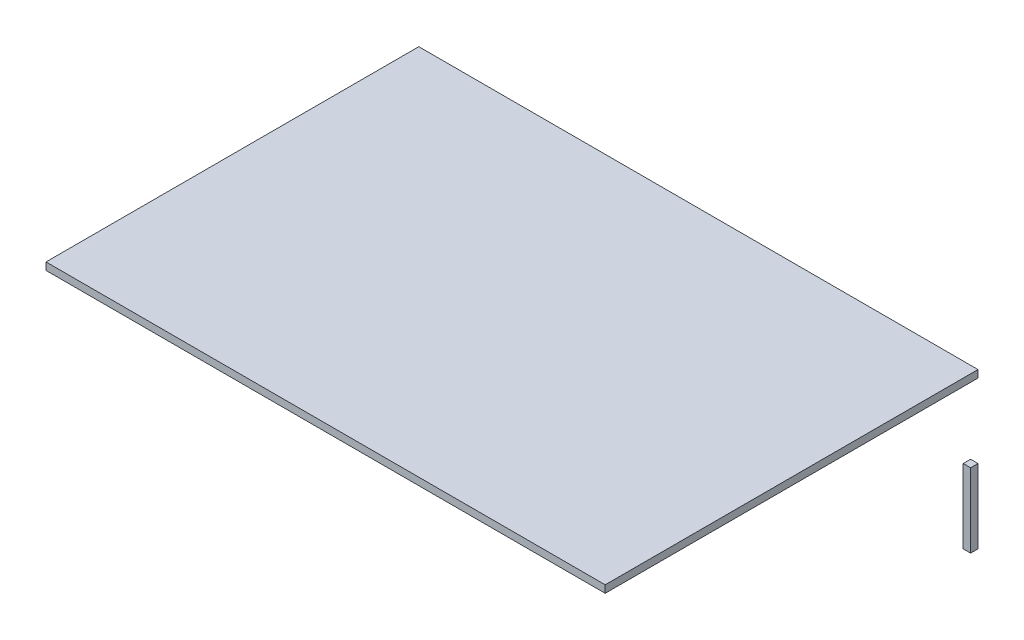
from build123d import *

# Parameters (mm, degrees)
SKETCH1_W            = 75
SKETCH1_H            = 50
BOSS_EXTRUDE1_DEPTH  = 10
BOSS_EXTRUDE2_DEPTH  = 2
SKETCH3_W            = 1
SKETCH3_H            = 12
SKETCH3_W_2          = 6
SKETCH3_H_2          = 0.5
BOSS_EXTRUDE3_DEPTH  = 2
BOSS_EXTRUDE4_DEPTH  = 2
BOSS_EXTRUDE6_DEPTH  = 10
CUT_EXTRUDE2_DEPTH   = 47.436300591
SKETCH9_W            = 24.9
SKETCH9_H            = 10
SKETCH9_W_2          = 0.6
BOSS_EXTRUDE8_DEPTH  = 0.2
CUT_EXTRUDE3_DEPTH   = 47.598819728
SKETCH11_W           = 75.4
SKETCH11_H           = 50.2
BOSS_EXTRUDE9_DEPTH  = 1
SKETCH12_W           = 75.6
SKETCH12_H           = 50.4
BOSS_EXTRUDE10_DEPTH = 1
SKETCH13_W           = 1
SKETCH13_H           = 1
BOSS_EXTRUDE11_DEPTH = 10
CUT_EXTRUDE4_DEPTH   = 47.823605158


with BuildPart() as part:
    # Sketch1 → Boss-Extrude1 (new body)
    with BuildSketch(Plane(origin=(0, 0, 0), x_dir=(1, 0, 0), z_dir=(0, 1, 0))):
        Rectangle(SKETCH1_W, SKETCH1_H)
    extrude(amount=BOSS_EXTRUDE1_DEPTH)

    # Sketch2 → Boss-Extrude2 (add)
    # profile 1 of 7: a face of its own
    with BuildSketch(Plane(origin=(0, 10, 0), x_dir=(1, 0, 0), z_dir=(0, 1, 0))):
        Polygon((15.076923077, 19.5), (19.025641026, 19.5), (19.025641026, 18.782051282), (15.705128205, 18.782051282), (15.705128205, 16.628205128), (19.025641026, 16.628205128), (19.025641026, 15.91025641), (15.705128205, 15.91025641), (15.705128205, 13.217948718), (19.025641026, 13.217948718), (19.025641026, 12.5), (15.076923077, 12.5), align=None)
    # profile 2 of 7: a face of its own
    with BuildSketch(Plane(origin=(0, 10, 0), x_dir=(1, 0, 0), z_dir=(0, 1, 0))):
        Polygon((7.897435897, 12.5), (7.897435897, 19.5), (8.029246795, 19.5), (12.653846154, 13.990584936), (12.653846154, 19.5), (13.282051282, 19.5), (13.282051282, 12.5), (13.139022436, 12.5), (8.525641026, 17.996794872), (8.525641026, 12.5), align=None)
    # profile 3 of 7: a face of its own
    with BuildSketch(Plane(origin=(0, 10, 0), x_dir=(1, 0, 0), z_dir=(0, 1, 0))):
        with BuildLine():
            add(Edge.make_bspline(
                [(2.737179487, 19.679487179), (2.866795699, 19.676204221), (3.121372633, 19.669756219), (3.495522428, 19.620398012), (3.852712619, 19.535007232), (4.195852897, 19.421281267), (4.52083885, 19.269572496), (4.830116635, 19.086202199), (5.122950382, 18.869249282), (5.395393145, 18.620390828), (5.644707046, 18.34962392), (5.864358818, 18.0606681), (6.048443406, 17.755270496), (6.19961498, 17.434348834), (6.3182122, 17.098628898), (6.400050287, 16.746320893), (6.452326587, 16.379707513), (6.458438142, 16.129653783), (6.461538462, 16.002804487)],
                knots=[0, 0, 0, 0, 1.065120563, 2.091984664, 3.0946048, 4.079830382, 5.057816894, 6.036188127, 7.030412546, 8.04752943, 9.064399622, 10.05169764, 11.02544977, 11.989514704, 12.962713494, 13.945757189, 14.957906945, 16, 16, 16, 16], degree=3))
            add(Edge.make_bspline(
                [(6.461538462, 16.002804487), (6.458438596, 15.876889594), (6.452328403, 15.628696754), (6.399990848, 15.264409865), (6.317908848, 14.914228472), (6.200716316, 14.578737167), (6.050265359, 14.257582039), (5.864955017, 13.951608131), (5.646672595, 13.660715135), (5.398258893, 13.388089804), (5.127456809, 13.138094863), (4.836996276, 12.920257111), (4.533409636, 12.732808862), (4.212790219, 12.583241514), (3.879390146, 12.463697673), (3.5302255, 12.382192413), (3.166932392, 12.329618327), (2.919190384, 12.323581295), (2.793269231, 12.320512821)],
                knots=[0, 0, 0, 0, 1.043624062, 2.057103931, 3.04512605, 4.022047818, 4.998200453, 5.980619268, 6.982898556, 8.009068085, 9.034988726, 10.034168286, 11.015286542, 11.987931943, 12.962482838, 13.94673481, 14.956375938, 16, 16, 16, 16], degree=3))
            add(Edge.make_bspline(
                [(2.793269231, 12.320512821), (2.666420593, 12.323611594), (2.416368161, 12.329720102), (2.04929409, 12.382082912), (1.696738602, 12.463965519), (1.3597099, 12.580984392), (1.038020041, 12.732218853), (0.731039875, 12.916627611), (0.440001581, 13.135441894), (0.167318088, 13.383775043), (-0.082180308, 13.654118147), (-0.29969906, 13.943786657), (-0.484149286, 14.24709757), (-0.634875951, 14.564892619), (-0.75420487, 14.895635504), (-0.835614506, 15.241532459), (-0.88828641, 15.600611471), (-0.894356103, 15.845097267), (-0.897435897, 15.969150641)],
                knots=[0, 0, 0, 0, 1.053102029, 2.075944431, 3.073151272, 4.055350789, 5.033113405, 6.020478099, 7.024410459, 8.052272461, 9.079885166, 10.07527673, 11.055994387, 12.023226415, 12.992069828, 13.970394897, 14.97016774, 16, 16, 16, 16], degree=3))
            add(Edge.make_bspline(
                [(-0.897435897, 15.969150641), (-0.896366626, 16.052415979), (-0.894241574, 16.217896226), (-0.868658189, 16.463629427), (-0.831534786, 16.705410742), (-0.778330961, 16.942552638), (-0.708747627, 17.174474607), (-0.626643573, 17.402776133), (-0.526363882, 17.625143581), (-0.413002586, 17.842630364), (-0.28647897, 18.051846176), (-0.146727471, 18.249605342), (0.001343266, 18.437567336), (0.163670053, 18.610861343), (0.334902944, 18.774528656), (0.5178197, 18.92605409), (0.711304189, 19.066803992), (0.916188948, 19.193644674), (1.127425498, 19.308362943), (1.345179054, 19.406806645), (1.566492197, 19.491298768), (1.792401493, 19.559780419), (2.022307037, 19.613844491), (2.256710606, 19.650659198), (2.495425458, 19.676307834), (2.656248096, 19.678422838), (2.737179487, 19.679487179)],
                knots=[0, 0, 0, 0, 1.037015668, 2.060948919, 3.074880161, 4.083647147, 5.086022904, 6.090072063, 7.104153813, 8.122640571, 9.144368836, 10.147691507, 11.138137339, 12.123020368, 13.103399296, 14.087645067, 15.080126199, 16.082011238, 17.087798457, 18.072939717, 19.057185487, 20.037253025, 21.01195951, 21.997135196, 22.992090687, 24, 24, 24, 24], degree=3))
        make_face()
        with BuildLine():
            add(Edge.make_bspline(
                [(2.768028846, 18.961538462), (2.701599579, 18.960728681), (2.569376113, 18.959116862), (2.372807041, 18.93788543), (2.178823173, 18.907625652), (1.987384449, 18.864462611), (1.79929187, 18.805654505), (1.612792188, 18.737972689), (1.42958608, 18.655530508), (1.250278364, 18.562385099), (1.076448214, 18.459287257), (0.912422811, 18.345343723), (0.757777523, 18.223226615), (0.61289099, 18.09265094), (0.478188645, 17.952951737), (0.351019242, 17.806246864), (0.236480079, 17.648343082), (0.131508926, 17.483522269), (0.037573245, 17.311999106), (-0.045957464, 17.135579382), (-0.114285482, 16.952824008), (-0.170010235, 16.765715693), (-0.216209856, 16.574550774), (-0.245477705, 16.377879076), (-0.266942423, 16.176688852), (-0.268462114, 16.040725144), (-0.269230769, 15.971955128)],
                knots=[0, 0, 0, 0, 1.008559885, 2.007477868, 2.99961109, 3.989939068, 4.984837346, 5.991145699, 7.001802488, 8.033829008, 9.059044045, 10.069351652, 11.065060232, 12.050310815, 13.029377138, 14.011219647, 14.996725999, 15.989392538, 16.977580475, 17.965360261, 18.951710183, 19.937753436, 20.929683414, 21.935841486, 22.955955122, 24, 24, 24, 24], degree=3))
            add(Edge.make_bspline(
                [(-0.269230769, 15.971955128), (-0.266681045, 15.870830687), (-0.26166495, 15.671887626), (-0.217749809, 15.380351338), (-0.15010586, 15.100174766), (-0.050391128, 14.832890947), (0.074310102, 14.576202381), (0.228363882, 14.332386172), (0.410882053, 14.101376423), (0.618209107, 13.884785885), (0.84485452, 13.687094277), (1.08551998, 13.51356746), (1.337627195, 13.36674696), (1.6018336, 13.247136815), (1.876728678, 13.15235734), (2.16408378, 13.087400077), (2.461984699, 13.044649167), (2.66504601, 13.040543655), (2.768028846, 13.038461538)],
                knots=[0, 0, 0, 0, 1.032063989, 2.030389145, 3.003944642, 3.970395727, 4.937377036, 5.913328081, 6.909231446, 7.93887556, 8.970685674, 9.976071282, 10.964166581, 11.944589148, 12.933237628, 13.927779006, 14.949070134, 16, 16, 16, 16], degree=3))
            add(Edge.make_bspline(
                [(2.768028846, 13.038461538), (2.837247849, 13.039412547), (2.974529922, 13.041298683), (3.178720967, 13.060296037), (3.37923339, 13.090759776), (3.57578595, 13.134621087), (3.768155573, 13.1895155), (3.957145179, 13.254730956), (4.14074176, 13.336093363), (4.321261435, 13.425989266), (4.494053919, 13.528469581), (4.659004983, 13.638545881), (4.811956943, 13.760483122), (4.956735086, 13.889118747), (5.091990464, 14.027046443), (5.216808432, 14.174086886), (5.330768697, 14.331168201), (5.43569999, 14.495739012), (5.529306515, 14.667731518), (5.610864713, 14.844790874), (5.680056945, 15.026481092), (5.735913955, 15.213064235), (5.779684878, 15.404185933), (5.809844718, 15.600102089), (5.830941595, 15.800420774), (5.83253175, 15.935908486), (5.833333333, 16.004206731)],
                knots=[0, 0, 0, 0, 1.047197238, 2.076906641, 3.100256066, 4.114471768, 5.12198147, 6.126382909, 7.136867548, 8.15857795, 9.17633901, 10.174870724, 11.156907918, 12.133735059, 13.104061851, 14.077631395, 15.04955518, 16.038496417, 17.029181396, 18.010275684, 18.986308667, 19.968651475, 20.955262928, 21.950658345, 22.966943676, 24, 24, 24, 24], degree=3))
            add(Edge.make_bspline(
                [(5.833333333, 16.004206731), (5.832531107, 16.072037739), (5.830939744, 16.20659304), (5.809854795, 16.405514676), (5.779653014, 16.600021099), (5.736127598, 16.789348705), (5.680027291, 16.973545755), (5.61085263, 17.152439251), (5.529282031, 17.326695641), (5.435665582, 17.495884235), (5.330433935, 17.658233711), (5.215445449, 17.813438536), (5.088714753, 17.958584019), (4.953862703, 18.097253407), (4.807520932, 18.226489186), (4.650352344, 18.346334227), (4.484264988, 18.459680776), (4.308410518, 18.5619319), (4.12692261, 18.656360365), (3.940694694, 18.737262371), (3.751836495, 18.80600661), (3.56082827, 18.86464054), (3.366062314, 18.9074566), (3.168854656, 18.9379127), (2.969478139, 18.959109472), (2.835391699, 18.960726229), (2.768028846, 18.961538462)],
                knots=[0, 0, 0, 0, 1.02996197, 2.043119294, 3.035359645, 4.018872909, 4.991431989, 5.957985074, 6.929999688, 7.912076566, 8.892894881, 9.867085534, 10.843653904, 11.817741046, 12.803660682, 13.806313499, 14.818574707, 15.856120519, 16.894564902, 17.924820532, 18.937903209, 19.946497019, 20.957711757, 21.963978472, 22.977135795, 24, 24, 24, 24], degree=3))
        make_face(mode=Mode.SUBTRACT)
    # profile 4 of 7: a face of its own
    with BuildSketch(Plane(origin=(0, 10, 0), x_dir=(1, 0, 0), z_dir=(0, 1, 0))):
        Polygon((-7.987179487, 18.782051282), (-7.987179487, 19.5), (-4.307692308, 19.5), (-4.307692308, 18.782051282), (-5.833333333, 18.782051282), (-5.833333333, 12.5), (-6.461538462, 12.5), (-6.461538462, 18.782051282), align=None)
    # profile 5 of 7: a face of its own
    with BuildSketch(Plane(origin=(0, 10, 0), x_dir=(1, 0, 0), z_dir=(0, 1, 0))):
        with BuildLine():
            Line((-12.743589744, 13.850360577), (-12.151842949, 14.205128205))
            add(Edge.make_bspline(
                [(-12.151842949, 14.205128205), (-12.096806474, 14.112999435), (-11.991358713, 13.936484267), (-11.815455995, 13.697968187), (-11.633190172, 13.495243873), (-11.443211505, 13.329490658), (-11.246679609, 13.198992884), (-11.042311502, 13.106588421), (-10.83079588, 13.04895647), (-10.686848237, 13.041956297), (-10.614983974, 13.038461538)],
                knots=[0, 0, 0, 0, 1.272034388, 2.437168799, 3.508375237, 4.49857839, 5.41946034, 6.295179144, 7.148887113, 8, 8, 8, 8], degree=3))
            add(Edge.make_bspline(
                [(-10.614983974, 13.038461538), (-10.553610253, 13.040170883), (-10.431936707, 13.043559664), (-10.252812221, 13.076121268), (-10.078848617, 13.126145526), (-9.913631341, 13.197787389), (-9.759440112, 13.28446436), (-9.624226722, 13.389156715), (-9.507334495, 13.506369127), (-9.411716266, 13.637134436), (-9.338356196, 13.777768733), (-9.281972059, 13.922120636), (-9.250681911, 14.072457773), (-9.245968404, 14.173678698), (-9.243589744, 14.224759615)],
                knots=[0, 0, 0, 0, 1.095163259, 2.171163733, 3.241058638, 4.321873601, 5.38011039, 6.391990106, 7.366004449, 8.327778327, 9.272591725, 10.192022065, 11.087607919, 12, 12, 12, 12], degree=3))
            add(Edge.make_bspline(
                [(-9.243589744, 14.224759615), (-9.246538365, 14.283041315), (-9.252532481, 14.401519493), (-9.303195442, 14.576318799), (-9.382893935, 14.749303939), (-9.456419223, 14.85630647), (-9.494591346, 14.911858974)],
                knots=[0, 0, 0, 0, 0.938893495, 1.908633276, 2.914225137, 4, 4, 4, 4], degree=3))
            add(Edge.make_bspline(
                [(-9.494591346, 14.911858974), (-9.525932575, 14.951952622), (-9.591729563, 15.036124219), (-9.704844588, 15.16141469), (-9.837576817, 15.290651528), (-9.985383927, 15.428769641), (-10.153650104, 15.569345235), (-10.337105133, 15.719081791), (-10.540432851, 15.872284945), (-10.683031844, 15.975030076), (-10.756610577, 16.028044872)],
                knots=[0, 0, 0, 0, 0.722233717, 1.516239348, 2.393582979, 3.351407094, 4.387010283, 5.505090956, 6.712668013, 8, 8, 8, 8], degree=3))
            add(Edge.make_bspline(
                [(-10.756610577, 16.028044872), (-10.830258569, 16.080502047), (-10.971067922, 16.180796172), (-11.167985087, 16.32964474), (-11.344074013, 16.465732479), (-11.498552046, 16.590340503), (-11.63135124, 16.703485712), (-11.743518062, 16.804081591), (-11.832195176, 16.894848712), (-11.881506337, 16.953731396), (-11.903645833, 16.980168269)],
                knots=[0, 0, 0, 0, 1.452282411, 2.77665338, 3.964542531, 5.026858415, 5.96415736, 6.766646006, 7.446254459, 8, 8, 8, 8], degree=3))
            add(Edge.make_bspline(
                [(-11.903645833, 16.980168269), (-11.934590924, 17.021370343), (-11.995448597, 17.10239975), (-12.075780608, 17.229049466), (-12.144058934, 17.358695997), (-12.197583598, 17.491687726), (-12.242656036, 17.626157584), (-12.272971897, 17.763860075), (-12.291954691, 17.904177312), (-12.293898664, 17.998604313), (-12.294871795, 18.045873397)],
                knots=[0, 0, 0, 0, 1.068054152, 2.10047183, 3.106115577, 4.101338837, 5.06977816, 6.043150881, 7.020423561, 8, 8, 8, 8], degree=3))
            add(Edge.make_bspline(
                [(-12.294871795, 18.045873397), (-12.292261377, 18.119932947), (-12.287096337, 18.266469074), (-12.243415302, 18.480530735), (-12.174469515, 18.684903569), (-12.077879739, 18.877564237), (-11.953365033, 19.053496199), (-11.809273085, 19.214723173), (-11.637650112, 19.350260337), (-11.449344866, 19.468684454), (-11.243232121, 19.561376304), (-11.027250315, 19.631298264), (-10.801056171, 19.67091678), (-10.647849901, 19.67660231), (-10.570112179, 19.679487179)],
                knots=[0, 0, 0, 0, 1.005424448, 1.989358655, 2.955360095, 3.929531133, 4.905563448, 5.876582895, 6.856512386, 7.866279853, 8.892233794, 9.918561126, 10.94386622, 12, 12, 12, 12], degree=3))
            add(Edge.make_bspline(
                [(-10.570112179, 19.679487179), (-10.487623979, 19.676642076), (-10.323581275, 19.670984074), (-10.082282844, 19.621789011), (-9.849961411, 19.540387668), (-9.663074882, 19.448010352), (-9.516809359, 19.35574752), (-9.405263894, 19.271707872), (-9.292228992, 19.174957655), (-9.176792882, 19.065239163), (-9.060911563, 18.94154566), (-8.942864659, 18.804724283), (-8.822376121, 18.655611171), (-8.744864401, 18.549162169), (-8.705128205, 18.494591346)],
                knots=[0, 0, 0, 0, 1.286793592, 2.559021753, 3.825965368, 5.121522368, 5.803751409, 6.523245864, 7.299691795, 8.125521123, 9.008227632, 9.944561021, 10.946284179, 12, 12, 12, 12], degree=3))
            Line((-8.705128205, 18.494591346), (-9.273036859, 18.064102564))
            add(Edge.make_bspline(
                [(-9.273036859, 18.064102564), (-9.307328724, 18.108279945), (-9.373366838, 18.193355251), (-9.473625812, 18.312497883), (-9.568123108, 18.421330842), (-9.661223907, 18.515861098), (-9.74801117, 18.601265364), (-9.832245255, 18.674384878), (-9.912713957, 18.735936069), (-10.014147778, 18.801623189), (-10.141583215, 18.866736196), (-10.301552288, 18.921834352), (-10.468724838, 18.954944476), (-10.582584101, 18.959322251), (-10.640224359, 18.961538462)],
                knots=[0, 0, 0, 0, 1.181633172, 2.275549214, 3.290209073, 4.226197932, 5.078386478, 5.862611352, 6.581680152, 7.217281963, 8.414376989, 9.595101626, 10.782541182, 12, 12, 12, 12], degree=3))
            add(Edge.make_bspline(
                [(-10.640224359, 18.961538462), (-10.712537404, 18.959115062), (-10.851986299, 18.954441763), (-11.049966771, 18.903401793), (-11.228154621, 18.823038072), (-11.381259751, 18.710408116), (-11.508733705, 18.57696613), (-11.600944623, 18.42340842), (-11.656444952, 18.253843615), (-11.663217511, 18.135560302), (-11.666666667, 18.075320513)],
                knots=[0, 0, 0, 0, 1.14458467, 2.207223713, 3.21896685, 4.227309161, 5.202851033, 6.127160689, 7.046193047, 8, 8, 8, 8], degree=3))
            add(Edge.make_bspline(
                [(-11.666666667, 18.075320513), (-11.665880413, 18.037817556), (-11.664306621, 17.962750317), (-11.642357026, 17.851847473), (-11.614158368, 17.741224794), (-11.569473104, 17.631379628), (-11.507782497, 17.52039091), (-11.426772145, 17.406347435), (-11.324745521, 17.288244018), (-11.246591497, 17.21142927), (-11.205328526, 17.170873397)],
                knots=[0, 0, 0, 0, 0.858281714, 1.717966888, 2.583508476, 3.4729293, 4.427298488, 5.488583878, 6.674047936, 8, 8, 8, 8], degree=3))
            add(Edge.make_bspline(
                [(-11.205328526, 17.170873397), (-11.190005781, 17.157199346), (-11.153602447, 17.124712929), (-11.087050595, 17.071528368), (-10.999164999, 17.005922823), (-10.892240596, 16.92474819), (-10.764305873, 16.830585266), (-10.615346761, 16.724638042), (-10.447023695, 16.603467124), (-10.327579863, 16.518752043), (-10.264423077, 16.473958333)],
                knots=[0, 0, 0, 0, 0.420754252, 0.999615792, 1.744751191, 2.668019286, 3.750313428, 4.999500688, 6.413464383, 8, 8, 8, 8], degree=3))
            add(Edge.make_bspline(
                [(-10.264423077, 16.473958333), (-10.18845125, 16.418675614), (-10.041342338, 16.311628291), (-9.832027178, 16.150796931), (-9.642239562, 15.993501394), (-9.471313154, 15.840746179), (-9.317559338, 15.693689993), (-9.182683896, 15.550563633), (-9.065312535, 15.412392487), (-8.938954099, 15.235247336), (-8.80983846, 15.017685167), (-8.698955445, 14.75112869), (-8.62903875, 14.483536049), (-8.619895719, 14.303682376), (-8.615384615, 14.21494391)],
                knots=[0, 0, 0, 0, 1.163667725, 2.253281268, 3.268753668, 4.215851969, 5.092017293, 5.902905408, 6.650798638, 7.335211899, 8.59617414, 9.77448103, 10.901945474, 12, 12, 12, 12], degree=3))
            add(Edge.make_bspline(
                [(-8.615384615, 14.21494391), (-8.616698892, 14.15218718), (-8.619301922, 14.027892413), (-8.649223749, 13.845382259), (-8.69306308, 13.66812052), (-8.759137548, 13.498298295), (-8.839783864, 13.33280877), (-8.94211636, 13.175992969), (-9.060731729, 13.024380172), (-9.196799259, 12.882013189), (-9.345691064, 12.751320797), (-9.503058453, 12.635062674), (-9.669158999, 12.538126027), (-9.843091632, 12.459024343), (-10.024896306, 12.397157308), (-10.214511873, 12.35233157), (-10.412250896, 12.324820148), (-10.546651859, 12.321964625), (-10.614983974, 12.320512821)],
                knots=[0, 0, 0, 0, 0.983748083, 1.948392443, 2.894712957, 3.844097841, 4.80183111, 5.778335162, 6.776009319, 7.81870978, 8.863265674, 9.881300176, 10.883814829, 11.87499822, 12.874611388, 13.892143829, 14.928324115, 16, 16, 16, 16], degree=3))
            add(Edge.make_bspline(
                [(-10.614983974, 12.320512821), (-10.66785466, 12.321535184), (-10.77293018, 12.323567034), (-10.928349144, 12.341529595), (-11.080628323, 12.366943803), (-11.227856887, 12.407291942), (-11.37193171, 12.456245897), (-11.512226179, 12.516522562), (-11.648808287, 12.588756965), (-11.782443452, 12.671347014), (-11.912791802, 12.767462503), (-12.038630737, 12.879409496), (-12.164089108, 13.004100506), (-12.285463901, 13.144921633), (-12.40521019, 13.299597798), (-12.520967009, 13.469576165), (-12.635130444, 13.653930873), (-12.70676138, 13.783661044), (-12.743589744, 13.850360577)],
                knots=[0, 0, 0, 0, 0.915332311, 1.819136955, 2.706846663, 3.586547465, 4.459518054, 5.340707479, 6.227863349, 7.133153174, 8.059268498, 9.028702269, 10.047606654, 11.120612155, 12.245963614, 13.433783089, 14.680604001, 16, 16, 16, 16], degree=3))
        make_face()
    # profile 6 of 7: a face of its own
    with BuildSketch(Plane(origin=(0, 10, 0), x_dir=(1, 0, 0), z_dir=(0, 1, 0))):
        Polygon((-17.230769231, 19.5), (-13.282051282, 19.5), (-13.282051282, 18.782051282), (-16.602564103, 18.782051282), (-16.602564103, 16.628205128), (-13.282051282, 16.628205128), (-13.282051282, 15.91025641), (-16.602564103, 15.91025641), (-16.602564103, 13.217948718), (-13.282051282, 13.217948718), (-13.282051282, 12.5), (-17.230769231, 12.5), align=None)
    # profile 7 of 7: a face of its own
    with BuildSketch(Plane(origin=(0, 10, 0), x_dir=(1, 0, 0), z_dir=(0, 1, 0))):
        Polygon((-21.987179487, 18.782051282), (-21.987179487, 19.5), (-18.307692308, 19.5), (-18.307692308, 18.782051282), (-19.833333333, 18.782051282), (-19.833333333, 12.5), (-20.461538462, 12.5), (-20.461538462, 18.782051282), align=None)
    extrude(amount=BOSS_EXTRUDE2_DEPTH)

    # Sketch3 → Boss-Extrude3 (add)
    with BuildSketch(Plane(origin=(0, 10, 0), x_dir=(1, 0, 0), z_dir=(0, 1, 0))):
        with Locations((-31, 0)):
            Rectangle(SKETCH3_W, SKETCH3_H)
        with Locations((-34.5, 0.25)):
            Rectangle(SKETCH3_W_2, SKETCH3_H_2)
        with Locations((-34.5, -0.25)):
            Rectangle(SKETCH3_W_2, SKETCH3_H_2)
        Polygon((-27.5, -6), (-27.5, 0), (-27.5, 6), (-26.5, 6), (-26.5, -6), align=None)
        with Locations((-23.5, 0.25)):
            Rectangle(SKETCH3_W_2, SKETCH3_H_2)
        with Locations((-23.5, -0.25)):
            Rectangle(SKETCH3_W_2, SKETCH3_H_2)
    extrude(amount=BOSS_EXTRUDE3_DEPTH)

    # Sketch4 → Boss-Extrude4 (add)
    with BuildSketch(Plane(origin=(0, 10, 0), x_dir=(1, 0, 0), z_dir=(0, 1, 0))):
        Polygon((-17.5, 0.5), (-17.5, 0), (-17.5, -0.5), (-11.5, -0.5), (-11.5, -6), (-10.5, -6), (-10.5, 3), (-11.5, 6), (-11.5, 0.5), align=None)
        Polygon((-7.5, -3), (-10.5, 6), (-10.5, 3), (-7.5, -6), align=None)
        Polygon((-10.5, 6), (-11.5, 6), (-10.5, 3), align=None)
        Polygon((-7.5, 6), (-7.5, -3), (-6.5, -6), (-6.5, -0.5), (-0.5, -0.5), (-0.5, 0.5), (-6.5, 0.5), (-6.5, 6), align=None)
        Polygon((-6.5, -6), (-7.5, -3), (-7.5, -6), align=None)
    extrude(amount=BOSS_EXTRUDE4_DEPTH)

    # Sketch6 → Boss-Extrude6 (add, through all)
    with BuildSketch(Plane(origin=(0, 10, 0), x_dir=(1, 0, 0), z_dir=(0, 1, 0))):
        Polygon((37.7, 25.2), (-37.7, 25.2), (-37.7, 0.3), (-31.3, 0.3), (-31.3, 5.8), (-30.7, 5.8), (-30.7, -5.8), (-31.3, -5.8), (-31.3, -0.3), (-37.7, -0.3), (-37.7, -25.2), (37.7, -25.2), align=None)
        Polygon((-37.5, 25), (-37.5, 0.5), (-31.5, 0.5), (-31.5, 6), (-30.5, 6), (-30.5, -6), (-31.5, -6), (-31.5, -0.5), (-37.5, -0.5), (-37.5, -25), (37.5, -25), (37.5, 25), align=None, mode=Mode.SUBTRACT)
    extrude(amount=-BOSS_EXTRUDE6_DEPTH)

    # Sketch8 → Cut-Extrude2 (cut, through all)
    with BuildSketch(Plane(origin=(0, 10, 0), x_dir=(1, 0, 0), z_dir=(0, 1, 0))):
        Polygon((-31.5, -0.5), (-37.5, -0.5), (-37.5, -25), (37.5, -25), (37.5, 25), (-37.5, 25), (-37.5, 0.5), (-31.5, 0.5), (-31.5, 6), (-30.5, 6), (-30.5, -6), (-31.5, -6), align=None)
    extrude(amount=-CUT_EXTRUDE2_DEPTH, mode=Mode.SUBTRACT)


with BuildPart() as cut_extrude2_piece_1:
    # of the separate pieces the step leaves, piece 1, a body of its own (cut_extrude2_pieces)
    add(part.part.solids().sort_by_distance((37.7, 0, 25.2))[0])

    # Sketch9 → Boss-Extrude8 (add)
    with BuildSketch(Plane.ZY.offset(37.7)):
        with Locations((-12.75, 5)):
            Rectangle(SKETCH9_W, SKETCH9_H)
        with Locations((0, 5)):
            Rectangle(SKETCH9_W_2, SKETCH9_H)
        with Locations((12.75, 5)):
            Rectangle(SKETCH9_W, SKETCH9_H)
    extrude(amount=BOSS_EXTRUDE8_DEPTH)

    # Sketch10 → Cut-Extrude3 (cut, through all)
    with BuildSketch(Plane(origin=(0, 10, 0), x_dir=(1, 0, 0), z_dir=(0, 1, 0))):
        Polygon((-37.7, 0.3), (-37.7, 25), (-37.5, 25), (-37.5, -25), (-37.7, -25), align=None)
    extrude(amount=-CUT_EXTRUDE3_DEPTH, mode=Mode.SUBTRACT)


with BuildPart() as cut_extrude2_piece_2:
    # of the separate pieces the step leaves, piece 2, a body of its own (cut_extrude2_pieces)
    add(part.part.solids().sort_by_distance((-17.5, 10, -0.5))[0])


with BuildPart() as cut_extrude2_piece_3:
    # of the separate pieces the step leaves, piece 3, a body of its own (cut_extrude2_pieces)
    add(part.part.solids().sort_by_distance((-27.5, 10, 6))[0])


with BuildPart() as cut_extrude2_piece_4:
    # of the separate pieces the step leaves, piece 4, a body of its own (cut_extrude2_pieces)
    add(part.part.solids().sort_by_distance((-0.897435897, 10, -15.969150641))[0])


with BuildPart() as cut_extrude2_piece_5:
    # of the separate pieces the step leaves, piece 5, a body of its own (cut_extrude2_pieces)
    add(part.part.solids().sort_by_distance((8.525641026, 10, -12.5))[0])


with BuildPart() as cut_extrude2_piece_6:
    # of the separate pieces the step leaves, piece 6, a body of its own (cut_extrude2_pieces)
    add(part.part.solids().sort_by_distance((19.025641026, 10, -16.628205128))[0])


with BuildPart() as cut_extrude2_piece_7:
    # of the separate pieces the step leaves, piece 7, a body of its own (cut_extrude2_pieces)
    add(part.part.solids().sort_by_distance((-17.230769231, 10, -12.5))[0])


with BuildPart() as cut_extrude2_piece_8:
    # of the separate pieces the step leaves, piece 8, a body of its own (cut_extrude2_pieces)
    add(part.part.solids().sort_by_distance((-10.614983974, 10, -12.320512821))[0])


with BuildPart() as cut_extrude2_piece_9:
    # of the separate pieces the step leaves, piece 9, a body of its own (cut_extrude2_pieces)
    add(part.part.solids().sort_by_distance((-6.461538462, 10, -18.782051282))[0])


with BuildPart() as cut_extrude2_piece_10:
    # of the separate pieces the step leaves, piece 10, a body of its own (cut_extrude2_pieces)
    add(part.part.solids().sort_by_distance((-20.461538462, 10, -18.782051282))[0])


with BuildPart() as cut_extrude3_piece_1:
    # of the separate pieces the step leaves, piece 1, a body of its own (cut_extrude3_pieces)
    add(cut_extrude2_piece_1.part.solids().sort_by_distance((37.7, 0, 25.2))[0])

    # Sketch13 → Boss-Extrude11 (add, through all)
    with BuildSketch(Plane(origin=(0, 10, 0), x_dir=(1, 0, 0), z_dir=(0, 1, 0))):
        with Locations((37.2, 24.7)):
            Rectangle(SKETCH13_W, SKETCH13_H)
    extrude(amount=-BOSS_EXTRUDE11_DEPTH)


with BuildPart() as cut_extrude3_piece_2:
    # of the separate pieces the step leaves, piece 2, a body of its own (cut_extrude3_pieces)
    add(cut_extrude2_piece_1.part.solids().sort_by_distance((-37.5, 0, -0.5))[0])


with BuildPart() as body_12:
    # Sketch11 → Boss-Extrude9 (new body)
    with BuildSketch(Plane(origin=(0, 20, 0), x_dir=(1, 0, 0), z_dir=(0, 1, 0))):
        with Locations((-0.2, 0.1)):
            Rectangle(SKETCH11_W, SKETCH11_H)
    extrude(amount=BOSS_EXTRUDE9_DEPTH)

    # Sketch12 → Boss-Extrude10 (add)
    with BuildSketch(Plane(origin=(0, 21, 0), x_dir=(1, 0, 0), z_dir=(0, 1, 0))):
        with Locations((-0.1, 0)):
            Rectangle(SKETCH12_W, SKETCH12_H)
    extrude(amount=-BOSS_EXTRUDE10_DEPTH)


with BuildPart() as cut_extrude4_tool:
    # Sketch14 → Cut-Extrude4 (new, through all)
    with BuildSketch(Plane(origin=(0, 10, 0), x_dir=(1, 0, 0), z_dir=(0, 1, 0))):
        Polygon((36.7, 24.2), (37.5, 24.2), (37.5, -25), (-37.7, -25), (-37.7, 25), (36.7, 25), align=None)
        Polygon((-37.7, 25), (36.7, 25), (36.7, 25.2), (-37.9, 25.2), (-37.9, -25.2), (37.7, -25.2), (37.7, 24.2), (37.5, 24.2), (37.5, -25), (-37.7, -25), align=None)
    extrude(amount=-CUT_EXTRUDE4_DEPTH)


with BuildPart() as cut_extrude3_piece_1_1:
    add(cut_extrude3_piece_1.part)

    # Cut-Extrude4: cut by cut_extrude4_tool
    add(cut_extrude4_tool.part, mode=Mode.SUBTRACT)


with BuildPart() as cut_extrude3_piece_2_1:
    add(cut_extrude3_piece_2.part)

    # Cut-Extrude4: cut by cut_extrude4_tool
    add(cut_extrude4_tool.part, mode=Mode.SUBTRACT)


solid = Compound([cut_extrude2_piece_2.part, cut_extrude2_piece_3.part, cut_extrude2_piece_4.part, cut_extrude2_piece_5.part, cut_extrude2_piece_6.part, cut_extrude2_piece_7.part, cut_extrude2_piece_8.part, cut_extrude2_piece_9.part, cut_extrude2_piece_10.part, body_12.part, cut_extrude3_piece_1_1.part, cut_extrude3_piece_2_1.part])
